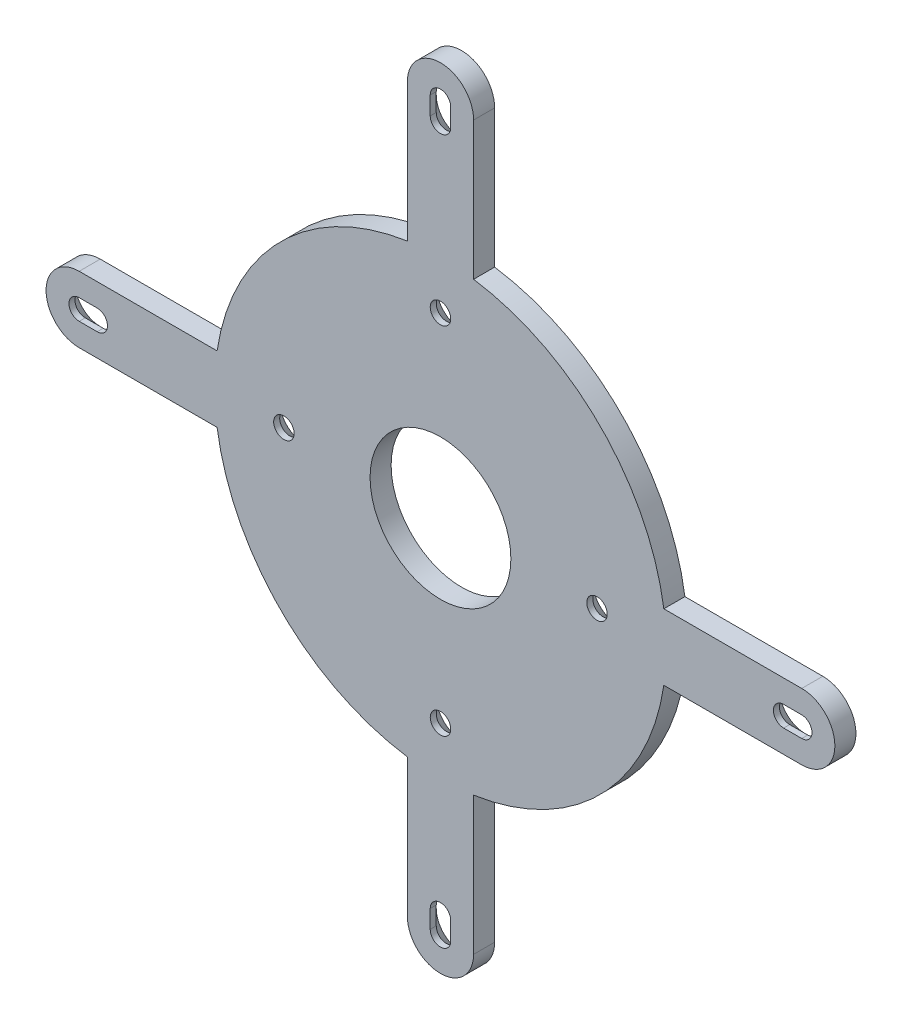
from build123d import *

# Parameters (mm, degrees)
BOSS_EXTRUDE1_DEPTH = 3.5
SKETCH1_3_R         = 1.7
CUT_EXTRUDE1_DEPTH  = 13
CHAMFER1_SIZE       = 2.5
SKETCH2_R           = 11.692051929
CUT_EXTRUDE2_DEPTH  = 10


with BuildPart() as part:
    # Sketch1 → Boss-Extrude1 (new body)
    with BuildSketch(Plane.XY):
        with BuildLine():
            Line((37.094473982, -5.5), (60, -5.5))
            ThreePointArc((60, -5.5), (65.5, 0), (60, 5.5))
            Line((60, 5.5), (37.094473982, 5.5))
            ThreePointArc((37.094473982, 5.5), (26.516504294, 26.516504294), (5.5, 37.094473982))
            Line((5.5, 37.094473982), (5.5, 60))
            ThreePointArc((5.5, 60), (0, 65.5), (-5.5, 60))
            Line((-5.5, 60), (-5.5, 37.094473982))
            ThreePointArc((-5.5, 37.094473982), (-26.516504294, 26.516504294), (-37.094473982, 5.5))
            Line((-37.094473982, 5.5), (-60, 5.5))
            ThreePointArc((-60, 5.5), (-65.5, 0), (-60, -5.5))
            Line((-60, -5.5), (-37.094473982, -5.5))
            ThreePointArc((-37.094473982, -5.5), (-26.516504294, -26.516504294), (-5.5, -37.094473982))
            Line((-5.5, -37.094473982), (-5.5, -60))
            ThreePointArc((-5.5, -60), (0, -65.5), (5.5, -60))
            Line((5.5, -60), (5.5, -37.094473982))
            ThreePointArc((5.5, -37.094473982), (26.516504294, -26.516504294), (37.094473982, -5.5))
        make_face()
        with BuildLine():
            ThreePointArc((60, 1.7), (61.7, 0), (60, -1.7))
            Line((60, -1.7), (57, -1.7))
            ThreePointArc((57, -1.7), (55.3, 0), (57, 1.7))
            Line((57, 1.7), (60, 1.7))
        make_face(mode=Mode.SUBTRACT)
        with BuildLine():
            Line((-1.7, -60), (-1.7, -57))
            ThreePointArc((-1.7, -57), (0, -55.3), (1.7, -57))
            Line((1.7, -57), (1.7, -60))
            ThreePointArc((1.7, -60), (0, -61.7), (-1.7, -60))
        make_face(mode=Mode.SUBTRACT)
        with BuildLine():
            Line((-60, 1.7), (-57, 1.7))
            ThreePointArc((-57, 1.7), (-55.3, 0), (-57, -1.7))
            Line((-57, -1.7), (-60, -1.7))
            ThreePointArc((-60, -1.7), (-61.7, 0), (-60, 1.7))
        make_face(mode=Mode.SUBTRACT)
        with BuildLine():
            Line((1.7, 60), (1.7, 57))
            ThreePointArc((1.7, 57), (0, 55.3), (-1.7, 57))
            Line((-1.7, 57), (-1.7, 60))
            ThreePointArc((-1.7, 60), (0, 61.7), (1.7, 60))
        make_face(mode=Mode.SUBTRACT)
    extrude(amount=BOSS_EXTRUDE1_DEPTH)

    # Sketch1<3> → Cut-Extrude1 (cut)
    with BuildSketch(Plane.XY):
        with Locations((0, 29.5)):
            Circle(SKETCH1_3_R)
        with Locations((26, 0)):
            Circle(SKETCH1_3_R)
        with Locations((-26, 0)):
            Circle(SKETCH1_3_R)
        with Locations((0, -29.5)):
            Circle(SKETCH1_3_R)
    extrude(amount=CUT_EXTRUDE1_DEPTH, mode=Mode.SUBTRACT)

    # Chamfer1
    chamfer1_edges = [part.edges().sort_by_distance(p)[0] for p in [
        (0, 55.3, 0),
        (1.7, 58.5, 0),
        (-1.7, 58.5, 0),
        (0, 61.7, 0),
        (-58.5, -1.7, 0),
        (-61.7, 0, 0),
        (-55.3, 0, 0),
        (-58.5, 1.7, 0),
        (0, -61.7, 0),
        (1.7, -58.5, 0),
        (-1.7, -58.5, 0),
        (0, -55.3, 0),
        (58.5, -1.7, 0),
        (61.7, 0, 0),
        (55.3, 0, 0),
        (58.5, 1.7, 0),
        (24.3, 0, 0),
        (-1.7, 29.5, 0),
        (-1.7, -29.5, 0),
        (-27.7, 0, 0),
    ]]
    chamfer(chamfer1_edges, length=CHAMFER1_SIZE)

    # Sketch2 → Cut-Extrude2 (cut)
    with BuildSketch(Plane(origin=(0, 0, 0), x_dir=(-1, 0, 0), z_dir=(0, 0, -1))):
        Circle(SKETCH2_R)
    extrude(amount=-CUT_EXTRUDE2_DEPTH, mode=Mode.SUBTRACT)


solid = part.part
